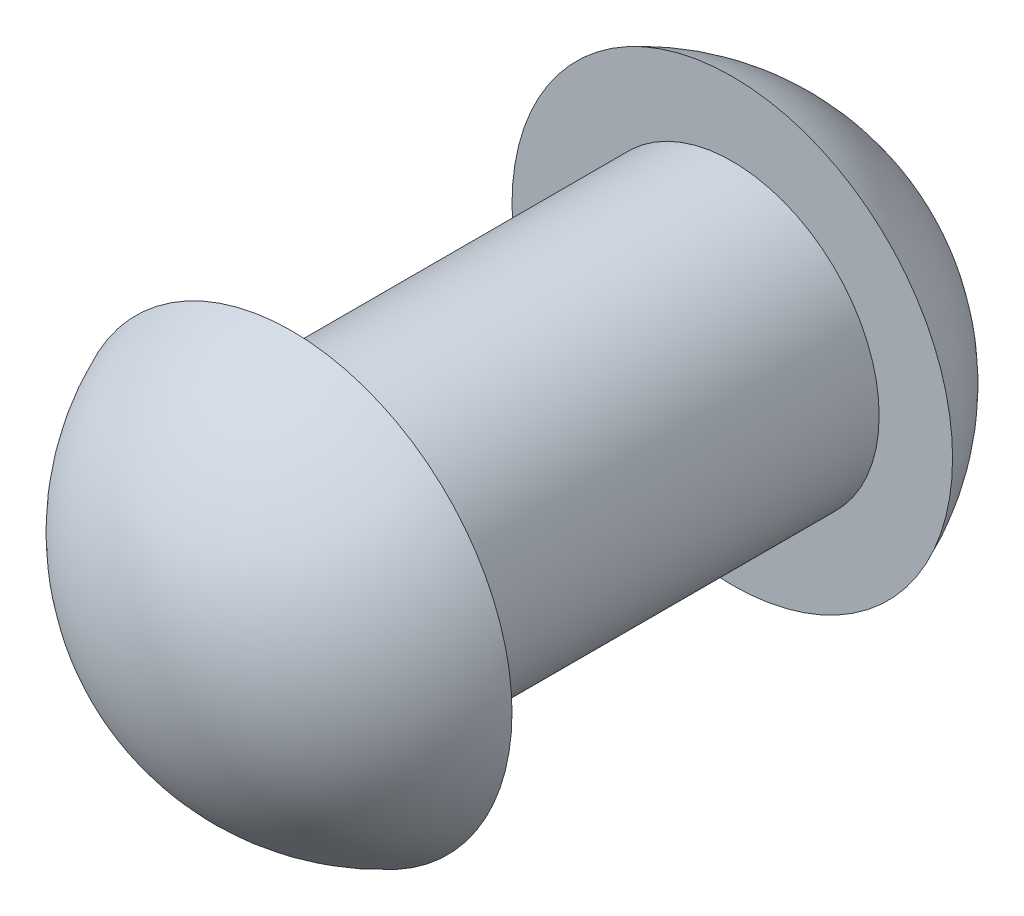
from build123d import *

# Parameters (mm, degrees)
SCALE_1_SCALE = 0.169230769


with BuildPart() as part:
    # 草图1 → 旋转1 (revolve)
    with BuildSketch(Plane(origin=(0, 0, 0), x_dir=(1, 0, 0), z_dir=(0, 1, 0)), mode=Mode.PRIVATE) as revolve_1_sk:
        with BuildLine():
            Line((0, 2.5), (0, -2.5))
            ThreePointArc((0, -2.5), (0.901387819, -2.227081728), (1.5, -1.5))
            Line((1.5, -1.5), (1, -1.5))
            Line((1, -1.5), (1, 1.5))
            Line((1, 1.5), (1.5, 1.5))
            ThreePointArc((1.5, 1.5), (0.901387819, 2.227081728), (0, 2.5))
        make_face()
    revolve(revolve_1_sk.sketch.rotate(Axis((0, 0, -2.5), (0, 0, 1)), 180), axis=Axis((0, 0, -2.5), (0, 0, 1)))


with BuildPart() as part_1:
    # 缩放比例1: scaled about (0, 0, 0)
    add(part.part.scale(SCALE_1_SCALE))


solid = part_1.part
